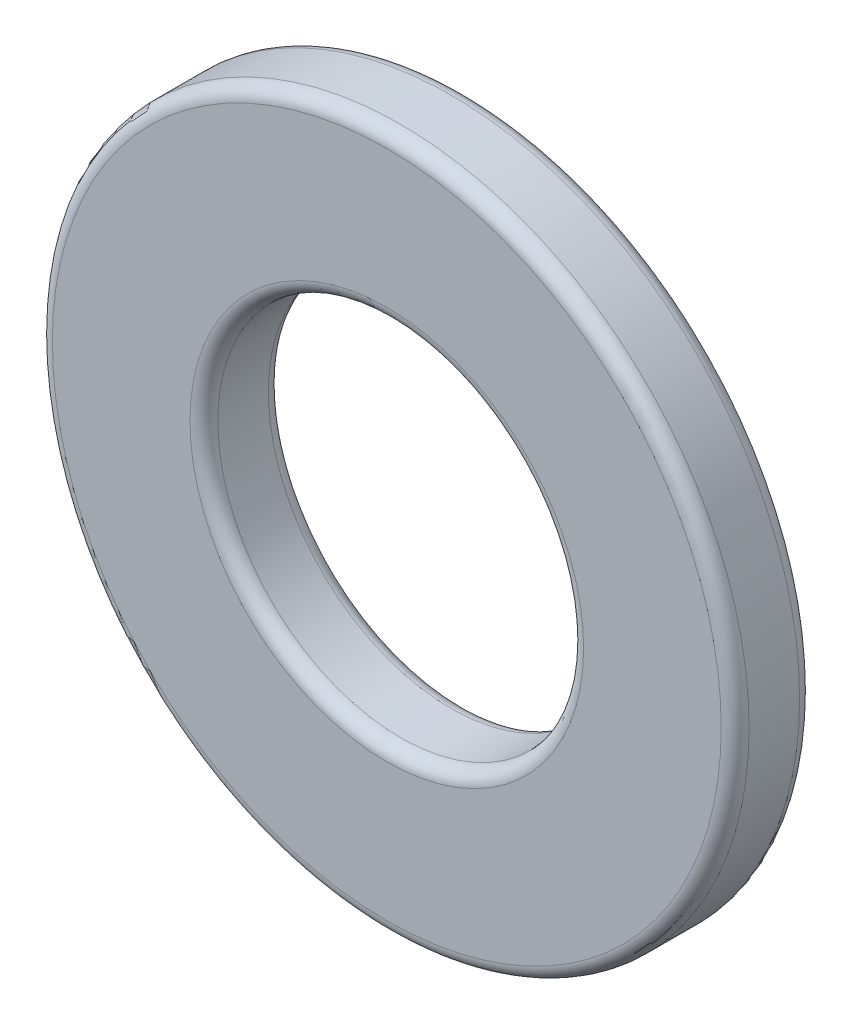
from build123d import *

# Parameters (mm, degrees)
BOSS_EXTRUDE1_DEPTH      = 0.9
BOSS_EXTRUDE1_DEPTH_BACK = 0.9
SKETCH3_R                = 8
SKETCH3_R_2              = 4.2
FILLET1_R                = 0.32


with BuildPart() as part:
    # Sketch3 → Boss-Extrude1 (new, two sides: drawn at the far end of the back side and taken through both)
    with BuildSketch(Plane.XY.offset(-BOSS_EXTRUDE1_DEPTH_BACK)):
        Circle(SKETCH3_R)
        Circle(SKETCH3_R_2, mode=Mode.SUBTRACT)
    extrude(amount=BOSS_EXTRUDE1_DEPTH + BOSS_EXTRUDE1_DEPTH_BACK)

    # Fillet1
    fillet1_edges = [part.edges().sort_by_distance(p)[0] for p in [
        (-8, 0, -0.9),
        (-4.2, 0, -0.9),
        (-8, 0, 0.9),
        (-4.2, 0, 0.9),
    ]]
    fillet(fillet1_edges, radius=FILLET1_R)


solid = part.part
